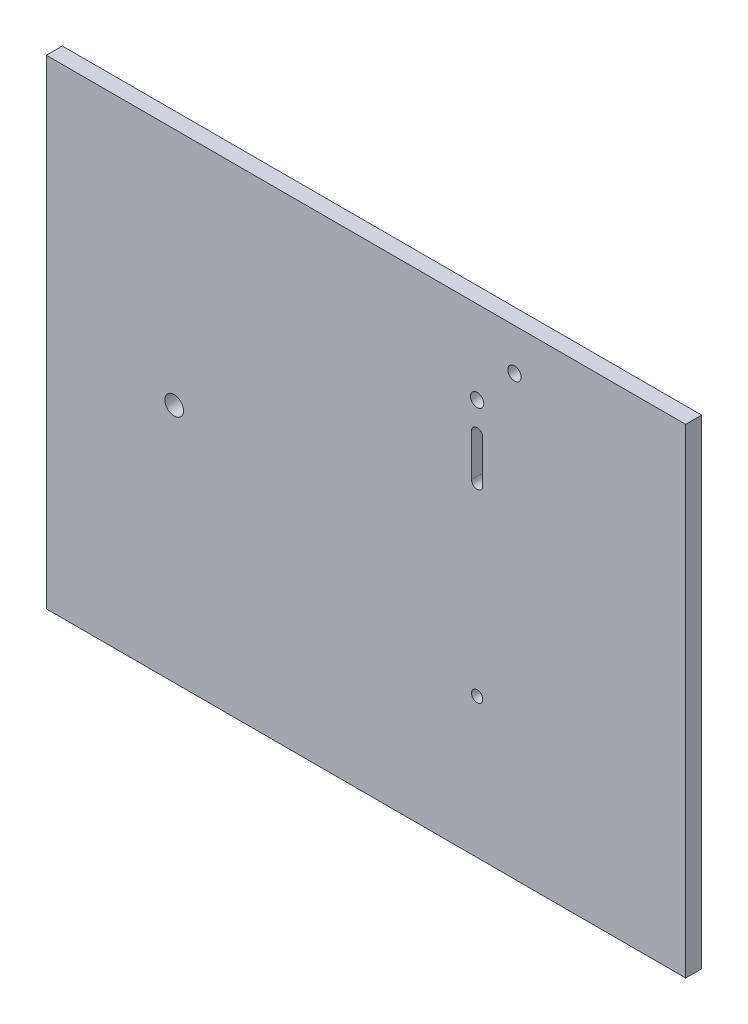
from build123d import *

# Parameters (mm, degrees)
SKETCH1_W           = 120
SKETCH1_H           = 90
BOSS_EXTRUDE1_DEPTH = 3
SKETCH3_R           = 1.75
SKETCH3_R_2         = 1.05
CUT_EXTRUDE1_DEPTH  = 3
SKETCH7_R           = 1.25
CUT_EXTRUDE3_DEPTH  = 3


with BuildPart() as part:
    # Sketch1 → Boss-Extrude1 (new body)
    with BuildSketch(Plane.XY):
        with Locations((60, -45)):
            Rectangle(SKETCH1_W, SKETCH1_H)
    extrude(amount=BOSS_EXTRUDE1_DEPTH)

    # Sketch3 → Cut-Extrude1 (cut)
    with BuildSketch(Plane.XY.offset(3)):
        with Locations((24, -44.9)):
            Circle(SKETCH3_R)
        with Locations((80.856366148, -63.762627499)):
            Circle(SKETCH3_R_2)
        with BuildLine():
            Line((79.806366148, -29.090746885), (79.806366148, -21.14956271))
            ThreePointArc((79.806366148, -21.14956271), (80.856366148, -20.09956271), (81.906366148, -21.14956271))
            Line((81.906366148, -21.14956271), (81.906366148, -29.090746885))
            ThreePointArc((81.906366148, -29.090746885), (80.856366148, -30.140746885), (79.806366148, -29.090746885))
        make_face()
    extrude(amount=-CUT_EXTRUDE1_DEPTH, mode=Mode.SUBTRACT)

    # Sketch7 → Cut-Extrude3 (cut)
    with BuildSketch(Plane.XY.offset(3)):
        with Locations((80.856366148, -15.59956271)):
            Circle(SKETCH7_R)
        with Locations((87.870361331, -7.785865021)):
            Circle(SKETCH7_R)
    extrude(amount=-CUT_EXTRUDE3_DEPTH, mode=Mode.SUBTRACT)


solid = part.part
